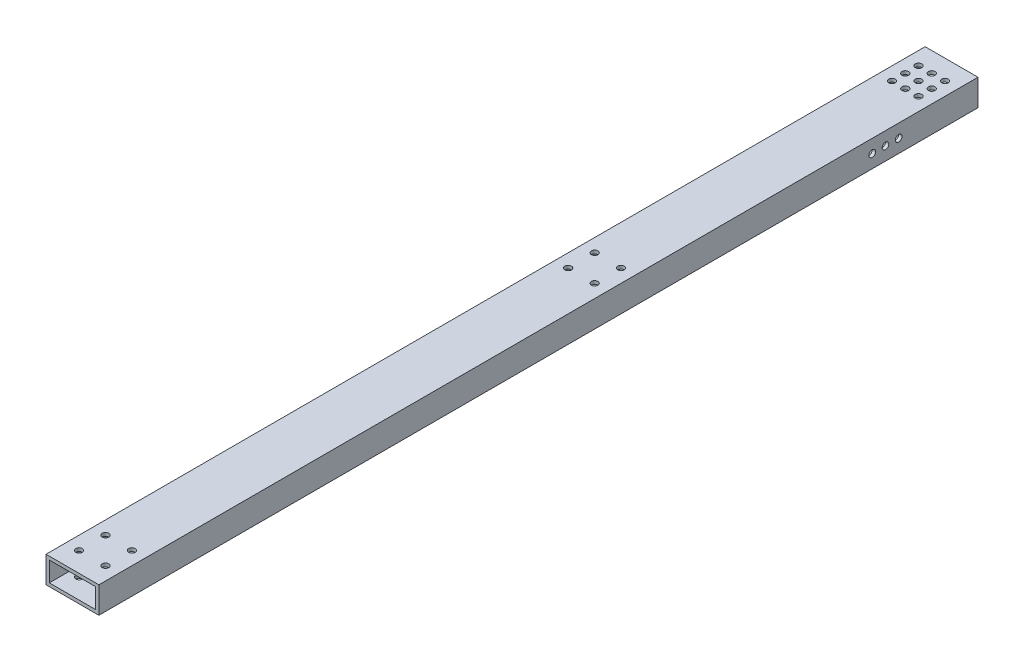
from build123d import *

# Parameters (mm, degrees)
SKETCH1_W               = 50.8
SKETCH1_H               = 25.4
SKETCH1_W_2             = 44.45
SKETCH1_H_2             = 19.05
BOSS_EXTRUDE1_DEPTH     = 844.55
CUT_EXTRUDE1_DEPTH      = 847.457620026
CUT_EXTRUDE1_DEPTH_BACK = 847.457620026
SKETCH2_R               = 3.175
CUT_EXTRUDE2_DEPTH      = 847.457620026
CUT_EXTRUDE2_DEPTH_BACK = 847.457620026
SKETCH3_R               = 3.175
SKETCH4_R               = 3.175
CUT_EXTRUDE3_DEPTH      = 847.457620026
SKETCH5_R               = 3.175
CUT_EXTRUDE4_DEPTH      = 847.457620026


with BuildPart() as part:
    # Sketch1 → Boss-Extrude1 (new body)
    with BuildSketch(Plane.XY):
        with Locations((25.4, 12.7)):
            Rectangle(SKETCH1_W, SKETCH1_H)
        with Locations((25.4, 12.7)):
            Rectangle(SKETCH1_W_2, SKETCH1_H_2, mode=Mode.SUBTRACT)
    extrude(amount=BOSS_EXTRUDE1_DEPTH)

    # Sketch2 → Cut-Extrude1 (cut, two sides: drawn at the far end of the back side and taken through both)
    with BuildSketch(Plane(origin=(50.8, 0, 0), x_dir=(0, 0, -1), z_dir=(1, 0, 0)).offset(-CUT_EXTRUDE1_DEPTH_BACK)):
        with Locations((-76.2, 12.7)):
            Circle(SKETCH2_R)
        with Locations((-88.9, 12.7)):
            Circle(SKETCH2_R)
        with Locations((-101.6, 12.7)):
            Circle(SKETCH2_R)
    extrude(amount=CUT_EXTRUDE1_DEPTH + CUT_EXTRUDE1_DEPTH_BACK, mode=Mode.SUBTRACT)

    # Sketch3 → Cut-Extrude2 (cut, two sides: drawn at the far end of the back side and taken through both)
    with BuildSketch(Plane(origin=(0, 25.4, 0), x_dir=(1, 0, 0), z_dir=(0, 1, 0)).offset(-CUT_EXTRUDE2_DEPTH_BACK)):
        with Locations(Location((12.7, -19.05, 0), (0, 0, 270))):
            Circle(SKETCH3_R)
        with Locations(Location((25.4, -19.05, 0), (0, 0, 270))):
            Circle(SKETCH3_R)
        with Locations(Location((38.1, -19.05, 0), (0, 0, 270))):
            Circle(SKETCH3_R)
        with Locations(Location((25.4, -31.75, 0), (0, 0, 270))):
            Circle(SKETCH3_R)
        with Locations(Location((38.1, -31.75, 0), (0, 0, 270))):
            Circle(SKETCH3_R)
        with Locations(Location((25.4, -44.45, 0), (0, 0, 270))):
            Circle(SKETCH3_R)
        with Locations(Location((38.1, -44.45, 0), (0, 0, 270))):
            Circle(SKETCH3_R)
        with Locations(Location((12.7, -31.75, 0), (0, 0, 270))):
            Circle(SKETCH3_R)
        with Locations(Location((12.7, -44.45, 0), (0, 0, 270))):
            Circle(SKETCH3_R)
    extrude(amount=CUT_EXTRUDE2_DEPTH + CUT_EXTRUDE2_DEPTH_BACK, mode=Mode.SUBTRACT)

    # Sketch4 → Cut-Extrude3 (cut, through all)
    with BuildSketch(Plane(origin=(0, 25.4, 0), x_dir=(1, 0, 0), z_dir=(0, 1, 0))):
        with Locations(Location((12.7, -330.2, 0), (0, 0, 270))):
            Circle(SKETCH4_R)
        with Locations(Location((38.1, -330.2, 0), (0, 0, 270))):
            Circle(SKETCH4_R)
        with Locations(Location((12.7, -355.6, 0), (0, 0, 270))):
            Circle(SKETCH4_R)
        with Locations(Location((38.1, -355.6, 0), (0, 0, 270))):
            Circle(SKETCH4_R)
    extrude(amount=-CUT_EXTRUDE3_DEPTH, mode=Mode.SUBTRACT)

    # Sketch5 → Cut-Extrude4 (cut, through all)
    with BuildSketch(Plane(origin=(0, 25.4, 0), x_dir=(1, 0, 0), z_dir=(0, 1, 0))):
        with Locations(Location((12.7, -825.5, 0), (0, 0, 270))):
            Circle(SKETCH5_R)
        with Locations(Location((38.1, -825.5, 0), (0, 0, 270))):
            Circle(SKETCH5_R)
        with Locations(Location((38.1, -800.1, 0), (0, 0, 270))):
            Circle(SKETCH5_R)
        with Locations(Location((12.7, -800.1, 0), (0, 0, 270))):
            Circle(SKETCH5_R)
    extrude(amount=-CUT_EXTRUDE4_DEPTH, mode=Mode.SUBTRACT)


solid = part.part
